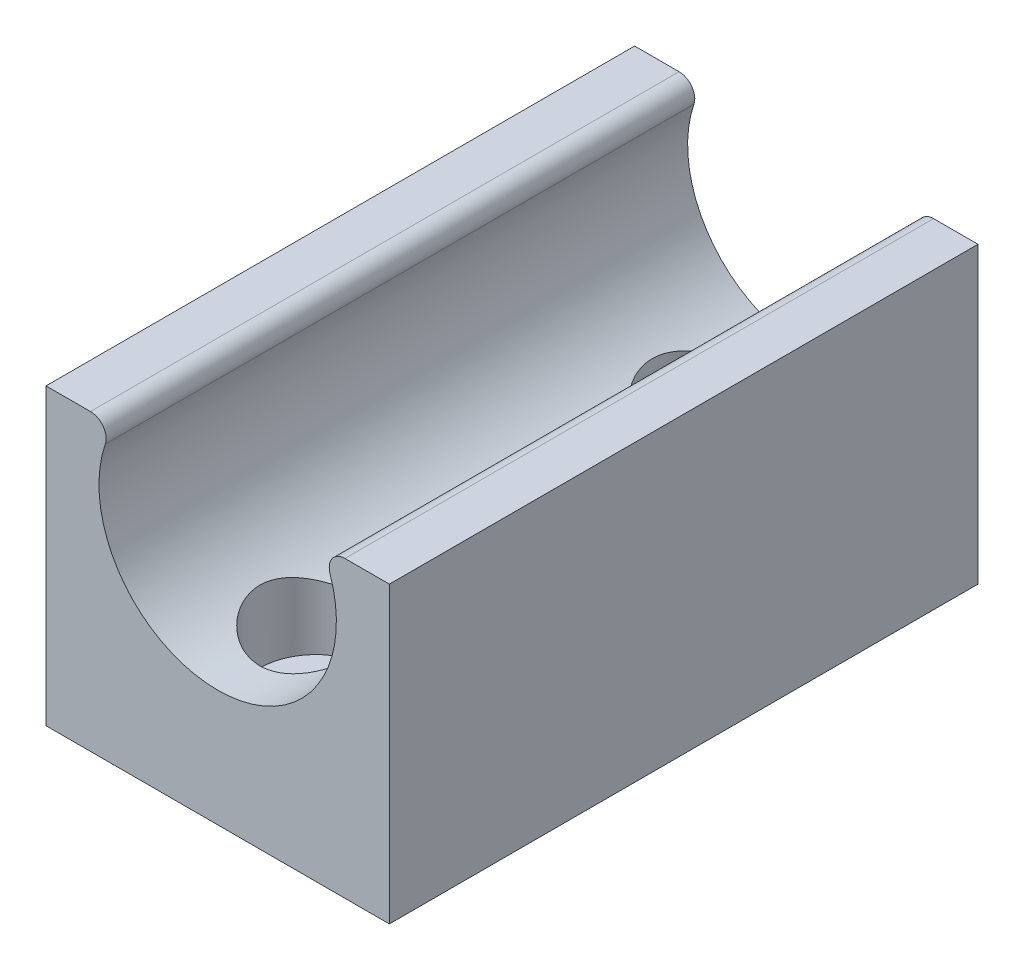
from build123d import *

# Parameters (mm, degrees)
BOSS_EXTRUDE1_DEPTH = 30
FILLET1_R           = 0.8
SKETCH3_R           = 2.85
CUT_EXTRUDE1_DEPTH  = 12
SKETCH4_R           = 1.55
CUT_EXTRUDE2_DEPTH  = 35.663561646


with BuildPart() as part:
    # Sketch1 → Boss-Extrude1 (new body)
    with BuildSketch(Plane.XY):
        with BuildLine():
            Line((-5.25, 7.5), (-8.75, 7.5))
            Line((-8.75, 7.5), (-8.75, -7.5))
            Line((-8.75, -7.5), (8.75, -7.5))
            Line((8.75, -7.5), (8.75, 7.5))
            Line((8.75, 7.5), (5.25, 7.5))
            ThreePointArc((5.25, 7.5), (0, -1.556659276), (-5.25, 7.5))
        make_face()
    extrude(amount=BOSS_EXTRUDE1_DEPTH)

    # Fillet1
    fillet1_edges = [part.edges().sort_by_distance(p)[0] for p in [
        (-5.25, 7.5, 15),
        (5.25, 7.5, 15),
    ]]
    fillet(fillet1_edges, radius=FILLET1_R)

    # Sketch3 → Cut-Extrude1 (cut)
    with BuildSketch(Plane(origin=(0, 7.5, 0), x_dir=(1, 0, 0), z_dir=(0, 1, 0))):
        with Locations(Location((0, -5, 0), (0, 0, 180))):
            Circle(SKETCH3_R)
        with Locations(Location((0, -25, 0), (0, 0, 180))):
            Circle(SKETCH3_R)
    extrude(amount=-CUT_EXTRUDE1_DEPTH, mode=Mode.SUBTRACT)

    # Sketch4 → Cut-Extrude2 (cut, through all)
    with BuildSketch(Plane(origin=(0, 7.5, 0), x_dir=(1, 0, 0), z_dir=(0, 1, 0))):
        with Locations(Location((0, -5, 0), (0, 0, 180))):
            Circle(SKETCH4_R)
        with Locations(Location((0, -25, 0), (0, 0, 180))):
            Circle(SKETCH4_R)
    extrude(amount=-CUT_EXTRUDE2_DEPTH, mode=Mode.SUBTRACT)


solid = part.part
